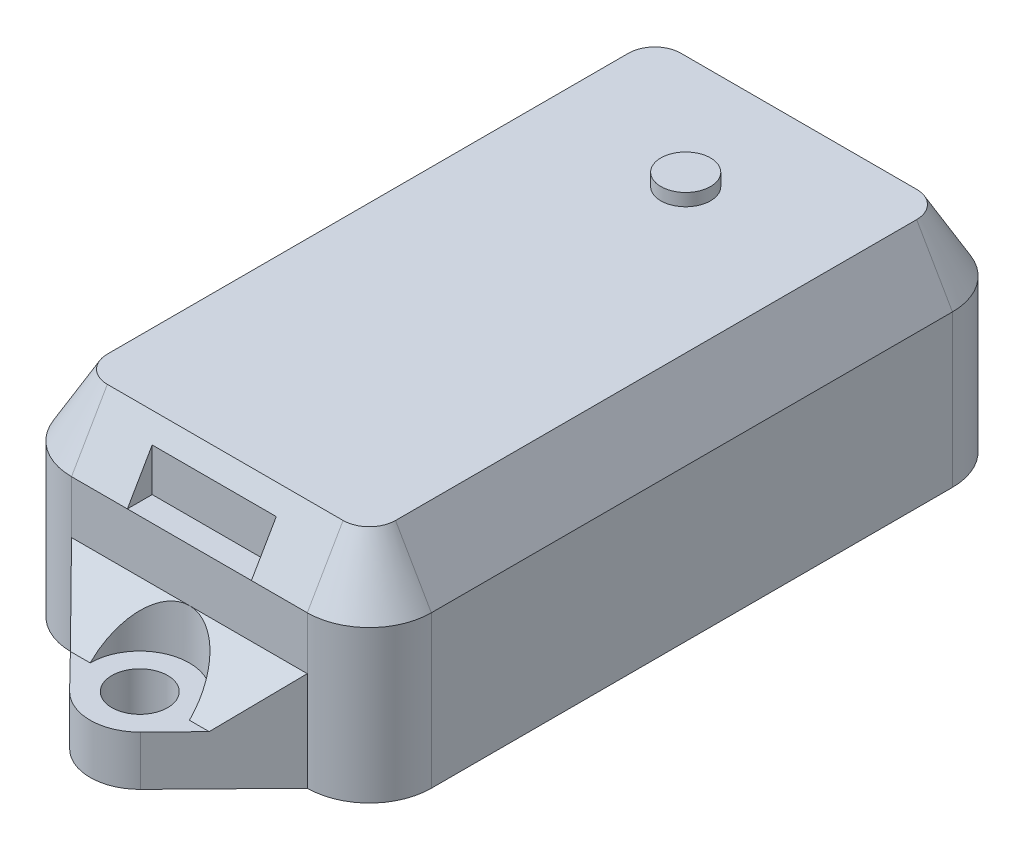
from build123d import *
from OCP.BRepFilletAPI import BRepFilletAPI_MakeChamfer
from build123d.topology import SkipClean

# Parameters (mm, degrees)
Y_KSEKLIK_EKSTR_ZYON2_DEPTH = 17.25
IZIM1_3_R                   = 2.25
Y_KSEKLIK_EKSTR_ZYON3_DEPTH = 4
PAH2_SIZE                   = 5
PAH2_SIZE2                  = 2.886751346
Y_KSEKLIK_EKSTR_ZYON4_DEPTH = 4
KES_EKSTR_ZYON2_DEPTH       = 24
IZIM7_W                     = 10
IZIM7_H                     = 2
KES_EKSTR_ZYON3_DEPTH       = 5
IZIM8_R                     = 2
Y_KSEKLIK_EKSTR_ZYON6_DEPTH = 1
IZIM10_R                    = 4
KES_EKSTR_ZYON4_DEPTH       = 10
IZIM11_R                    = 4
KES_EKSTR_ZYON5_DEPTH       = 10
KES_EKSTR_ZYON6_DEPTH       = 30


with BuildPart() as part:
    # Çizim1 → Yükseklik-Ekstrüzyon2 (new body)
    with BuildSketch(Plane(origin=(0, 0, 0), x_dir=(1, 0, 0), z_dir=(0, 1, 0))):
        with BuildLine():
            ThreePointArc((0, 5), (1.464466094, 1.464466094), (5, 0))
            Line((5, 0), (24, 0))
            ThreePointArc((24, 0), (27.535533906, 1.464466094), (29, 5))
            Line((29, 5), (29, 47))
            ThreePointArc((29, 47), (27.535533906, 50.535533906), (24, 52))
            Line((24, 52), (5, 52))
            ThreePointArc((5, 52), (1.464466094, 50.535533906), (0, 47))
            Line((0, 47), (0, 5))
        make_face()
    extrude(amount=Y_KSEKLIK_EKSTR_ZYON2_DEPTH)

    # Çizim1<3> → Yükseklik-Ekstrüzyon3 (add)
    # profile 1 of 2: a face of its own
    with BuildSketch(Plane(origin=(0, 0, 0), x_dir=(1, 0, 0), z_dir=(0, 1, 0))):
        with BuildLine():
            Line((24, 0), (5, 0))
            Line((5, 0), (11.638823529, -6.795294118))
            ThreePointArc((11.638823529, -6.795294118), (14.5, -8), (17.361176471, -6.795294118))
            Line((17.361176471, -6.795294118), (24, 0))
        make_face()
        with Locations((14.5, -4)):
            Circle(IZIM1_3_R, mode=Mode.SUBTRACT)
    # profile 2 of 2: a face of its own
    with BuildSketch(Plane(origin=(0, 0, 0), x_dir=(1, 0, 0), z_dir=(0, 1, 0))):
        with BuildLine():
            Line((11.638823529, 58.795294118), (5, 52))
            Line((5, 52), (24, 52))
            Line((24, 52), (17.361176471, 58.795294118))
            ThreePointArc((17.361176471, 58.795294118), (14.5, 60), (11.638823529, 58.795294118))
        make_face()
        with Locations((14.5, 56)):
            Circle(IZIM1_3_R, mode=Mode.SUBTRACT)
    extrude(amount=Y_KSEKLIK_EKSTR_ZYON3_DEPTH)

    # Pah2: one chamfer whose edges measure the first distance from different faces: ONE call of the kernel's chamfer builder (chamfer() names one face for all edges)
    pah2_edges_1 = [part.edges().sort_by_distance(p)[0] for p in [
        (27.535533906, 17.25, -1.464466094),
    ]]
    pah2_side_1 = [part.faces().sort_by_distance(p)[0] for p in [
        (27.535533906, 8.625, -1.464466094),
    ]]
    pah2_edges_2 = [part.edges().sort_by_distance(p)[0] for p in [
        (14.5, 17.25, 0),
    ]]
    pah2_side_2 = [part.faces().sort_by_distance(p)[0] for p in [
        (14.5, 10.625, 0),
    ]]
    pah2_edges_3 = [part.edges().sort_by_distance(p)[0] for p in [
        (1.464466094, 17.25, -1.464466094),
    ]]
    pah2_side_3 = [part.faces().sort_by_distance(p)[0] for p in [
        (1.464466094, 8.625, -1.464466094),
    ]]
    pah2_edges_4 = [part.edges().sort_by_distance(p)[0] for p in [
        (0, 17.25, -26),
    ]]
    pah2_side_4 = [part.faces().sort_by_distance(p)[0] for p in [
        (0, 8.625, -26),
    ]]
    pah2_edges_5 = [part.edges().sort_by_distance(p)[0] for p in [
        (1.464466094, 17.25, -50.535533906),
    ]]
    pah2_side_5 = [part.faces().sort_by_distance(p)[0] for p in [
        (1.464466094, 8.625, -50.535533906),
    ]]
    pah2_edges_6 = [part.edges().sort_by_distance(p)[0] for p in [
        (14.5, 17.25, -52),
    ]]
    pah2_side_6 = [part.faces().sort_by_distance(p)[0] for p in [
        (14.5, 10.625, -52),
    ]]
    pah2_edges_7 = [part.edges().sort_by_distance(p)[0] for p in [
        (27.535533906, 17.25, -50.535533906),
    ]]
    pah2_side_7 = [part.faces().sort_by_distance(p)[0] for p in [
        (27.535533906, 8.625, -50.535533906),
    ]]
    pah2_edges_8 = [part.edges().sort_by_distance(p)[0] for p in [
        (29, 17.25, -26),
    ]]
    pah2_side_8 = [part.faces().sort_by_distance(p)[0] for p in [
        (29, 8.625, -26),
    ]]
    pah2 = BRepFilletAPI_MakeChamfer(part.part.solid().wrapped)
    for e in pah2_edges_1:
        pah2.Add(PAH2_SIZE, PAH2_SIZE2, e.wrapped, pah2_side_1[0].wrapped)  # the first distance lies on this face
    for e in pah2_edges_2:
        pah2.Add(PAH2_SIZE, PAH2_SIZE2, e.wrapped, pah2_side_2[0].wrapped)  # the first distance lies on this face
    for e in pah2_edges_3:
        pah2.Add(PAH2_SIZE, PAH2_SIZE2, e.wrapped, pah2_side_3[0].wrapped)  # the first distance lies on this face
    for e in pah2_edges_4:
        pah2.Add(PAH2_SIZE, PAH2_SIZE2, e.wrapped, pah2_side_4[0].wrapped)  # the first distance lies on this face
    for e in pah2_edges_5:
        pah2.Add(PAH2_SIZE, PAH2_SIZE2, e.wrapped, pah2_side_5[0].wrapped)  # the first distance lies on this face
    for e in pah2_edges_6:
        pah2.Add(PAH2_SIZE, PAH2_SIZE2, e.wrapped, pah2_side_6[0].wrapped)  # the first distance lies on this face
    for e in pah2_edges_7:
        pah2.Add(PAH2_SIZE, PAH2_SIZE2, e.wrapped, pah2_side_7[0].wrapped)  # the first distance lies on this face
    for e in pah2_edges_8:
        pah2.Add(PAH2_SIZE, PAH2_SIZE2, e.wrapped, pah2_side_8[0].wrapped)  # the first distance lies on this face
    add(Compound.cast(pah2.Shape()), mode=Mode.REPLACE)

    # Çizim4 → Yükseklik-Ekstrüzyon4 (add)
    with SkipClean():  # the faces are left unmerged after this step: merging them gives an invalid solid
        with BuildSketch(Plane(origin=(0, 4, 0), x_dir=(1, 0, 0), z_dir=(0, 1, 0))):
            with BuildLine():
                Line((8.907894737, 56), (12.25, 56))
                ThreePointArc((12.25, 56), (14.5, 53.75), (16.75, 56))
                Line((16.75, 56), (20.092105263, 56))
                Line((20.092105263, 56), (24, 52))
                Line((24, 52), (5, 52))
                Line((5, 52), (8.907894737, 56))
            make_face()
            with BuildLine():
                Line((5, 0), (8.907894737, -4))
                Line((8.907894737, -4), (12.25, -4))
                ThreePointArc((12.25, -4), (14.5, -1.75), (16.75, -4))
                Line((16.75, -4), (20.092105263, -4))
                Line((20.092105263, -4), (24, 0))
                Line((24, 0), (5, 0))
            make_face()
        extrude(amount=Y_KSEKLIK_EKSTR_ZYON4_DEPTH)

    # Çizim5 → Kes-Ekstrüzyon2 (cut)
    with SkipClean():  # the faces are left unmerged after this step: merging them gives an invalid solid
        with BuildSketch(Plane.ZY):
            Polygon((0, 8), (4, 4), (4, 8), align=None)
        extrude(amount=-KES_EKSTR_ZYON2_DEPTH, mode=Mode.SUBTRACT)

    # Çizim7 → Kes-Ekstrüzyon3 (cut)
    with SkipClean():  # the faces are left unmerged after this step: merging them gives an invalid solid
        with BuildSketch(Plane(origin=(0, 17.25, 0), x_dir=(1, 0, 0), z_dir=(0, 1, 0))):
            with Locations((14.5, 1)):
                Rectangle(IZIM7_W, IZIM7_H)
        extrude(amount=-KES_EKSTR_ZYON3_DEPTH, mode=Mode.SUBTRACT)

    # Çizim8 → Yükseklik-Ekstrüzyon6 (add)
    with SkipClean():  # the faces are left unmerged after this step: merging them gives an invalid solid
        with BuildSketch(Plane(origin=(0, 17.25, 0), x_dir=(1, 0, 0), z_dir=(0, 1, 0))):
            with Locations((14.5, 40)):
                Circle(IZIM8_R)
        extrude(amount=Y_KSEKLIK_EKSTR_ZYON6_DEPTH)

    # Çizim10 → Kes-Ekstrüzyon4 (cut)
    with SkipClean():  # the faces are left unmerged after this step: merging them gives an invalid solid
        with BuildSketch(Plane(origin=(0, 4, 0), x_dir=(1, 0, 0), z_dir=(0, 1, 0))):
            with Locations((14.5, 56)):
                Circle(IZIM10_R)
        extrude(amount=KES_EKSTR_ZYON4_DEPTH, mode=Mode.SUBTRACT)

    # Çizim11 → Kes-Ekstrüzyon5 (cut)
    with BuildSketch(Plane(origin=(0, 4, 0), x_dir=(1, 0, 0), z_dir=(0, 1, 0))):
        with Locations((14.5, -4)):
            Circle(IZIM11_R)
    extrude(amount=KES_EKSTR_ZYON5_DEPTH, mode=Mode.SUBTRACT)

    # Çizim12 → Kes-Ekstrüzyon6 (cut)
    with BuildSketch(Plane.ZY):
        Polygon((-52, 8), (-56, 8), (-56, 4), align=None)
    extrude(amount=-KES_EKSTR_ZYON6_DEPTH, mode=Mode.SUBTRACT)


solid = part.part
